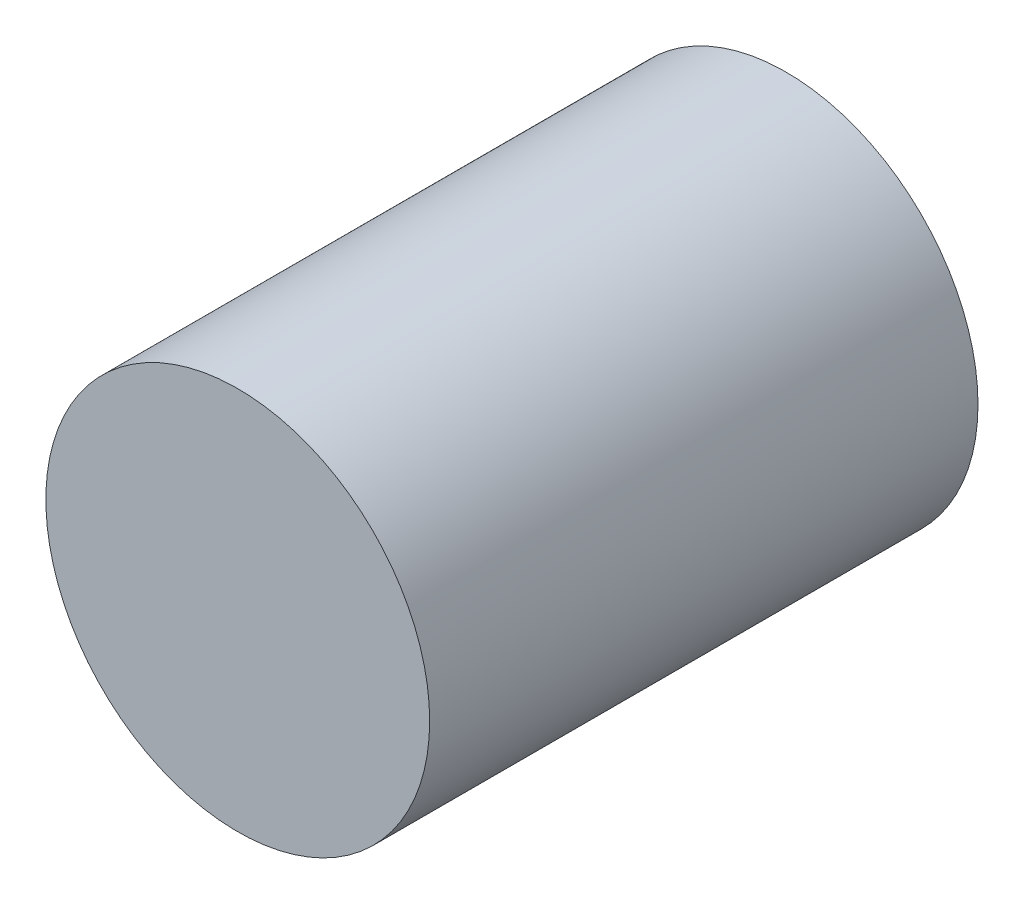
from build123d import *

# Parameters (mm, degrees)
SKETCH1_R           = 4.445
BOSS_EXTRUDE1_DEPTH = 12.7


with BuildPart() as part:
    # Sketch1 → Boss-Extrude1 (new body)
    with BuildSketch(Plane.XY):
        Circle(SKETCH1_R)
    extrude(amount=BOSS_EXTRUDE1_DEPTH)


solid = part.part
